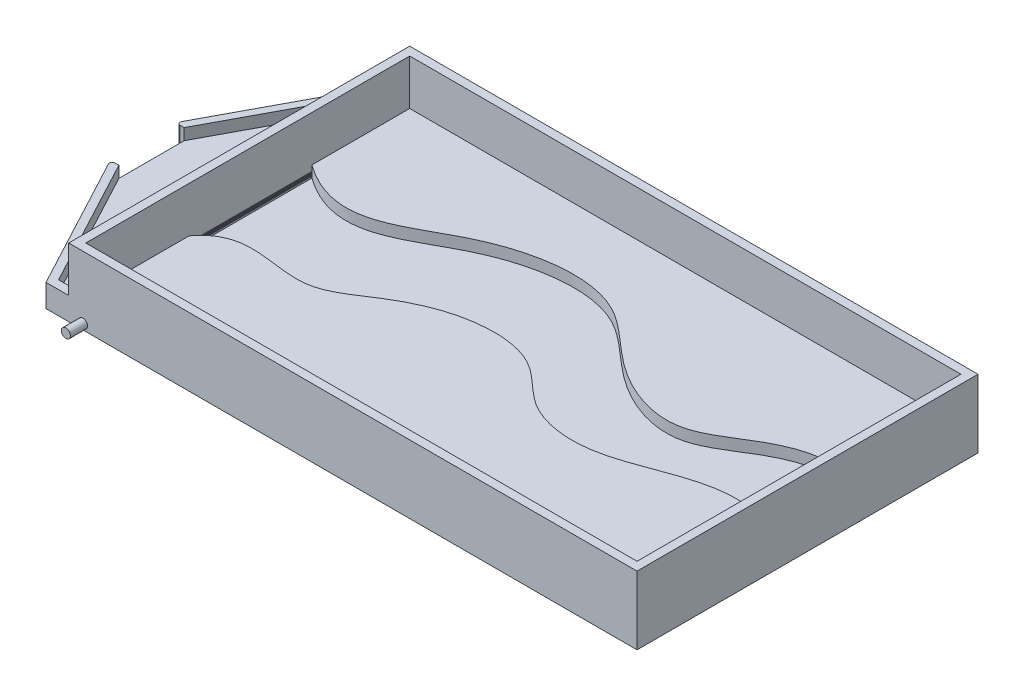
from build123d import *

# Parameters (mm, degrees)
SKETCH1_W           = 1000
SKETCH1_H           = 600
BOSS_EXTRUDE1_DEPTH = 20
SKETCH4_W           = 970
SKETCH4_H           = 570
BOSS_EXTRUDE3_DEPTH = 100
SKETCH5_W           = 570
SKETCH5_H           = 1
CUT_EXTRUDE4_DEPTH  = 100
SKETCH9_W           = 40
SKETCH9_H           = 300
BOSS_EXTRUDE4_DEPTH = 40
CUT_EXTRUDE5_DEPTH  = 20
CUT_EXTRUDE8_DEPTH  = 40
FILLET1_R           = 5
SKETCH13_R          = 15
CUT_EXTRUDE10_DEPTH = 10
SKETCH2_R           = 8
BOSS_EXTRUDE5_DEPTH = 30
BOSS_EXTRUDE6_START = 30
SKETCH3_R           = 8
BOSS_EXTRUDE6_DEPTH = 30
BOSS_EXTRUDE8_DEPTH = 20


with BuildPart() as part:
    # Sketch1 → Boss-Extrude1 (new body)
    with BuildSketch(Plane(origin=(0, 0, 0), x_dir=(1, 0, 0), z_dir=(0, 1, 0))):
        with Locations((500, -300)):
            Rectangle(SKETCH1_W, SKETCH1_H)
    extrude(amount=-BOSS_EXTRUDE1_DEPTH)

    # Sketch4 → Boss-Extrude3 (add)
    with BuildSketch(Plane(origin=(0, 0, 0), x_dir=(1, 0, 0), z_dir=(0, 1, 0))):
        Polygon((985, 0), (0, 0), (0, -600), (1000, -600), (1000, 0), align=None)
        with Locations((500, -300)):
            Rectangle(SKETCH4_W, SKETCH4_H, mode=Mode.SUBTRACT)
    extrude(amount=BOSS_EXTRUDE3_DEPTH)

    # Sketch5 → Cut-Extrude4 (cut)
    with BuildSketch(Plane(origin=(15, 0, 0), x_dir=(0, 0, -1), z_dir=(1, 0, 0))):
        with Locations((-300, 3.5)):
            Rectangle(SKETCH5_W, SKETCH5_H)
        with Locations((-300, 5.5)):
            Rectangle(SKETCH5_W, SKETCH5_H)
        with Locations((-300, 7.5)):
            Rectangle(SKETCH5_W, SKETCH5_H)
        with Locations((-300, 9.5)):
            Rectangle(SKETCH5_W, SKETCH5_H)
    extrude(amount=-CUT_EXTRUDE4_DEPTH, mode=Mode.SUBTRACT)

    # Sketch9 → Boss-Extrude4 (add)
    with BuildSketch(Plane(origin=(0, -20, 0), x_dir=(-1, 0, 0), z_dir=(0, -1, 0))):
        with Locations((20, -150)):
            Rectangle(SKETCH9_W, SKETCH9_H)
        with Locations((20, -450)):
            Rectangle(SKETCH9_W, SKETCH9_H)
        Polygon((40, -300), (40, -600), (200, -300), align=None)
        Polygon((40, 0), (40, -300), (200, -300), align=None)
    extrude(amount=-BOSS_EXTRUDE4_DEPTH)

    # Sketch10 → Cut-Extrude5 (cut)
    with BuildSketch(Plane(origin=(0, 20, 0), x_dir=(1, 0, 0), z_dir=(0, 1, 0))):
        Polygon((-32.882131169, -15), (-185, -300), (-32.882131169, -585), (0, -585), (0, -15), align=None)
    extrude(amount=-CUT_EXTRUDE5_DEPTH, mode=Mode.SUBTRACT)

    # Sketch12 → Cut-Extrude8 (cut)
    with BuildSketch(Plane(origin=(0, 20, 0), x_dir=(1, 0, 0), z_dir=(0, 1, 0))):
        Polygon((-154.365546922, -300), (-154.365546922, -242.604907667), (-169.389284089, -242.604907667), (-200, -300), (-169.389284089, -357.395092333), (-154.365546922, -357.395092333), align=None)
    extrude(amount=-CUT_EXTRUDE8_DEPTH, mode=Mode.SUBTRACT)

    # Fillet1
    fillet1_edges = [part.edges().sort_by_distance(p)[0] for p in [
        (-169.389284089, 0, 357.395092333),
        (-169.389284089, 0, 242.604907667),
    ]]
    fillet(fillet1_edges, radius=FILLET1_R)

    # Sketch13 → Cut-Extrude10 (cut)
    with BuildSketch(Plane(origin=(0, -20, 0), x_dir=(-1, 0, 0), z_dir=(0, -1, 0))):
        with Locations(Location((-700, -300, 0), (0, 0, 90))):
            Circle(SKETCH13_R)
        with Locations(Location((-850, -300, 0), (0, 0, 90))):
            Circle(SKETCH13_R)
        with Locations(Location((-550, -300, 0), (0, 0, 90))):
            Circle(SKETCH13_R)
    extrude(amount=-CUT_EXTRUDE10_DEPTH, mode=Mode.SUBTRACT)

    # Sketch2 → Boss-Extrude5 (add)
    with BuildSketch(Plane.XY.offset(600)):
        with Locations((25, -10)):
            Circle(SKETCH2_R)
    extrude(amount=BOSS_EXTRUDE5_DEPTH)

    # Sketch3 → Boss-Extrude6 (add)
    with BuildSketch(Plane(origin=(0, 0, 0), x_dir=(-1, 0, 0), z_dir=(0, 0, -1)).offset(BOSS_EXTRUDE6_START)):
        with Locations(Location((-25, -10, 0), (0, 0, 180))):
            Circle(SKETCH3_R)
    extrude(amount=-BOSS_EXTRUDE6_DEPTH)

    # Sketch14 → Boss-Extrude8 (add)
    with BuildSketch(Plane(origin=(0, 0, 0), x_dir=(1, 0, 0), z_dir=(0, 1, 0))):
        with BuildLine():
            Line((985, -220.808334487), (985, -15))
            Line((985, -15), (15, -15))
            Line((15, -15), (15, -187.21187033))
            add(Edge.make_bspline(
                [(15, -187.21187033), (124.719890795, -265.420288021), (239.941554954, -138.330767199), (485.474739291, -103.562224537), (593.939880912, -232.151341364), (733.720800914, -286.492070141), (845.878875539, -194.569242684), (947.375015923, -167.628315857), (985, -220.808334487)],
                knots=[0, 0, 0, 0, 0.268883391, 0.47609509, 0.600698085, 0.739638126, 0.845533083, 1, 1, 1, 1], degree=3))
        make_face()
        with BuildLine():
            Line((985, -350.394696236), (985, -585))
            Line((985, -585), (15, -585))
            Line((15, -585), (15, -403.189139911))
            add(Edge.make_bspline(
                [(15, -403.189139911), (64.499324983, -337.050425789), (173.991359683, -407.882670131), (289.800754445, -316.886525176), (391.178087844, -274.810977377), (510.180148048, -285.042641922), (576.080536092, -369.34637534), (690.491991673, -387.162809592), (819.400344159, -331.202995168), (921.945239203, -306.403251299), (985, -350.394696236)],
                knots=[0, 0, 0, 0, 0.186364679, 0.276053057, 0.40293442, 0.506803328, 0.593094347, 0.697797138, 0.814364056, 1, 1, 1, 1], degree=3))
        make_face()
    extrude(amount=BOSS_EXTRUDE8_DEPTH)


solid = part.part
